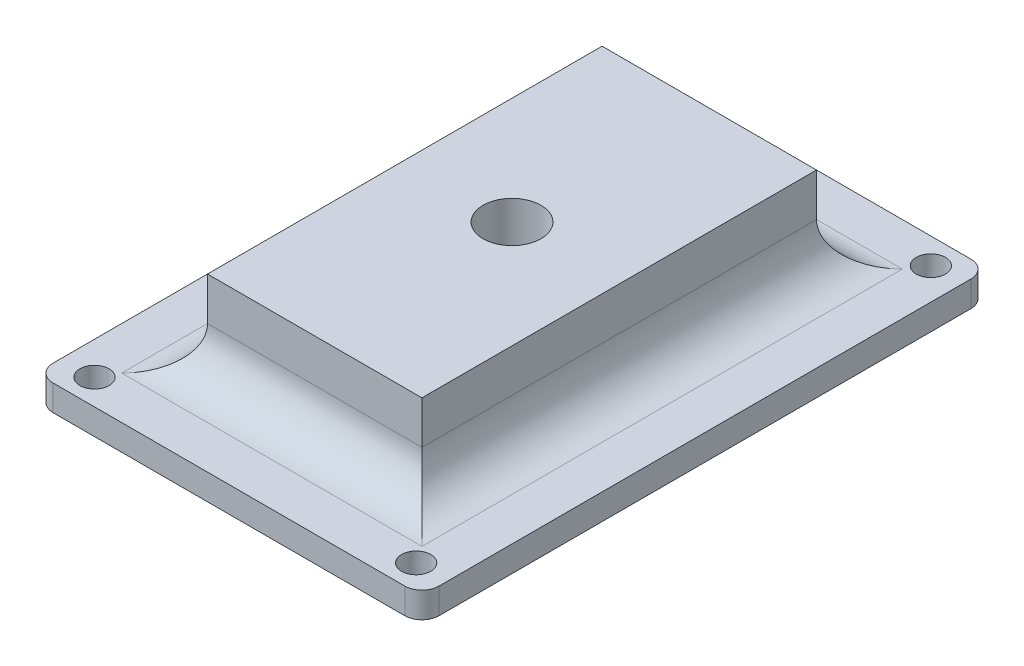
from build123d import *

# Parameters (mm, degrees)
CROQUIS1_W                                           = 45
CROQUIS1_H                                           = 66
SALIENTE_EXTRUIR1_DEPTH                              = 3
REDONDEO1_R                                          = 2
CROQUIS2_W                                           = 25
CROQUIS2_H                                           = 46
SALIENTE_EXTRUIR2_DEPTH                              = 10
REDONDEO2_R                                          = 5
REDONDEO3_R                                          = 5
AVELLANADO_PARA_TORNILLO_CON_CABEZA_OVAL_D           = 6.7564
AVELLANADO_PARA_TORNILLO_CON_CABEZA_OVAL_CSINK_D     = 12.8778
AVELLANADO_PARA_TORNILLO_CON_CABEZA_OVAL_CSINK_ANGLE = 82
TALADRO_DE_MARGEN_PARA_M31_D                         = 3.4


with BuildPart() as part:
    # Croquis1 → Saliente-Extruir1 (new body)
    with BuildSketch(Plane(origin=(0, 95.1, 0), x_dir=(1, 0, 0), z_dir=(0, 1, 0))):
        with Locations((305.171572875, 0)):
            Rectangle(CROQUIS1_W, CROQUIS1_H)
        with BuildLine():
            ThreePointArc((323.15, 30), (324, 29.15), (324.85, 30))
            ThreePointArc((324.85, 30), (324, 30.85), (323.15, 30))
        make_face(mode=Mode.SUBTRACT)
        with BuildLine():
            ThreePointArc((285.65, 30), (286.5, 29.15), (287.35, 30))
            ThreePointArc((287.35, 30), (286.5, 30.85), (285.65, 30))
        make_face(mode=Mode.SUBTRACT)
        with BuildLine():
            ThreePointArc((285.65, -30), (286.5, -30.85), (287.35, -30))
            ThreePointArc((287.35, -30), (286.5, -29.15), (285.65, -30))
        make_face(mode=Mode.SUBTRACT)
        with BuildLine():
            ThreePointArc((323.15, -30), (324, -30.85), (324.85, -30))
            ThreePointArc((324.85, -30), (324, -29.15), (323.15, -30))
        make_face(mode=Mode.SUBTRACT)
    extrude(amount=SALIENTE_EXTRUIR1_DEPTH)

    # Redondeo1
    redondeo1_edges = [part.edges().sort_by_distance(p)[0] for p in [
        (282.671572875, 96.6, -33),
        (327.671572875, 96.6, -33),
        (327.671572875, 96.6, 33),
        (282.671572875, 96.6, 33),
    ]]
    fillet(redondeo1_edges, radius=REDONDEO1_R)

    # Croquis2 → Saliente-Extruir2 (add)
    with BuildSketch(Plane(origin=(0, 98.1, 0), x_dir=(1, 0, 0), z_dir=(0, 1, 0))):
        with Locations((305.171572875, 0)):
            Rectangle(CROQUIS2_W, CROQUIS2_H)
    extrude(amount=SALIENTE_EXTRUIR2_DEPTH)

    # Redondeo2
    redondeo2_edges = [part.edges().sort_by_distance(p)[0] for p in [
        (305.171572875, 98.1, -23),
        (305.171572875, 98.1, 23),
    ]]
    fillet(redondeo2_edges, radius=REDONDEO2_R)

    # Redondeo3
    redondeo3_edges = [part.edges().sort_by_distance(p)[0] for p in [
        (292.671572875, 98.1, 0),
        (317.671572875, 98.1, 0),
    ]]
    fillet(redondeo3_edges, radius=REDONDEO3_R)

    # Avellanado para tornillo con cabeza ovalada de 1/41 (through all)
    with Locations(Plane(origin=(0, 95.1, 0), x_dir=(-1, 0, 0), z_dir=(0, -1, 0))):
        with Locations((-305.171572875, 0)):
            CounterSinkHole(AVELLANADO_PARA_TORNILLO_CON_CABEZA_OVAL_D / 2, AVELLANADO_PARA_TORNILLO_CON_CABEZA_OVAL_CSINK_D / 2, counter_sink_angle=AVELLANADO_PARA_TORNILLO_CON_CABEZA_OVAL_CSINK_ANGLE)

    # Taladro de margen para M31 (through all)
    with Locations(Plane(origin=(0, 98.1, 0), x_dir=(1, 0, 0), z_dir=(0, 1, 0))):
        with Locations((324, -30), (286.5, -30), (324, 30), (286.5, 30)):
            Hole(TALADRO_DE_MARGEN_PARA_M31_D / 2)


solid = part.part
